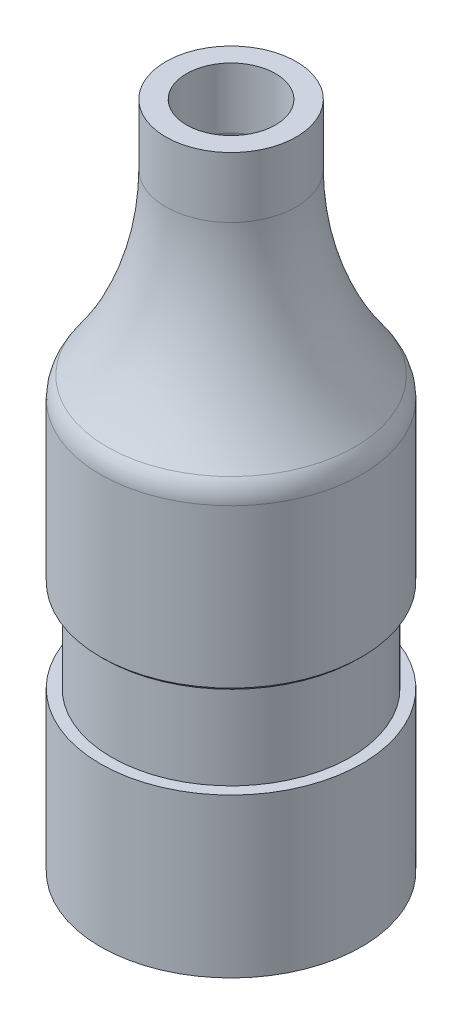
from build123d import *


with BuildPart() as part:
    # Sketch3 → Revolve1 (revolve)
    with BuildSketch(Plane.XY, mode=Mode.PRIVATE) as revolve1_sk:
        with BuildLine():
            Line((6.35, 12.95), (6.35, 5))
            Line((6.35, 5), (7.55, 5))
            Line((7.55, 5), (7.55, 14.15))
            Line((7.55, 14.15), (6.9, 14.15))
            Line((6.9, 14.15), (6.9, 19.3))
            Line((6.9, 19.3), (7.35, 19.3))
            Line((7.35, 19.3), (7.55, 19.5))
            Line((7.55, 19.5), (7.55, 28.622504621))
            ThreePointArc((7.55, 28.622504621), (7.449953131, 29.247146997), (7.159821902, 29.80929586))
            ThreePointArc((7.159821902, 29.80929586), (4.639195549, 34.693179743), (3.77, 40.12))
            Line((3.77, 40.12), (3.77, 43.62))
            Line((3.77, 43.62), (2.57, 43.62))
            Line((2.57, 43.62), (2.57, 40.12))
            Line((2.57, 40.12), (4.75, 29.3))
            Line((4.75, 29.3), (4.75, 20.5))
            Line((4.75, 20.5), (4.95, 20.5))
            Line((4.95, 20.5), (4.95, 12.95))
            Line((4.95, 12.95), (6.35, 12.95))
        make_face()
    revolve(revolve1_sk.sketch.rotate(Axis((0, 43.62, 0), (0, -1, 0)), 90), axis=Axis((0, 43.62, 0), (0, -1, 0)))


solid = part.part
